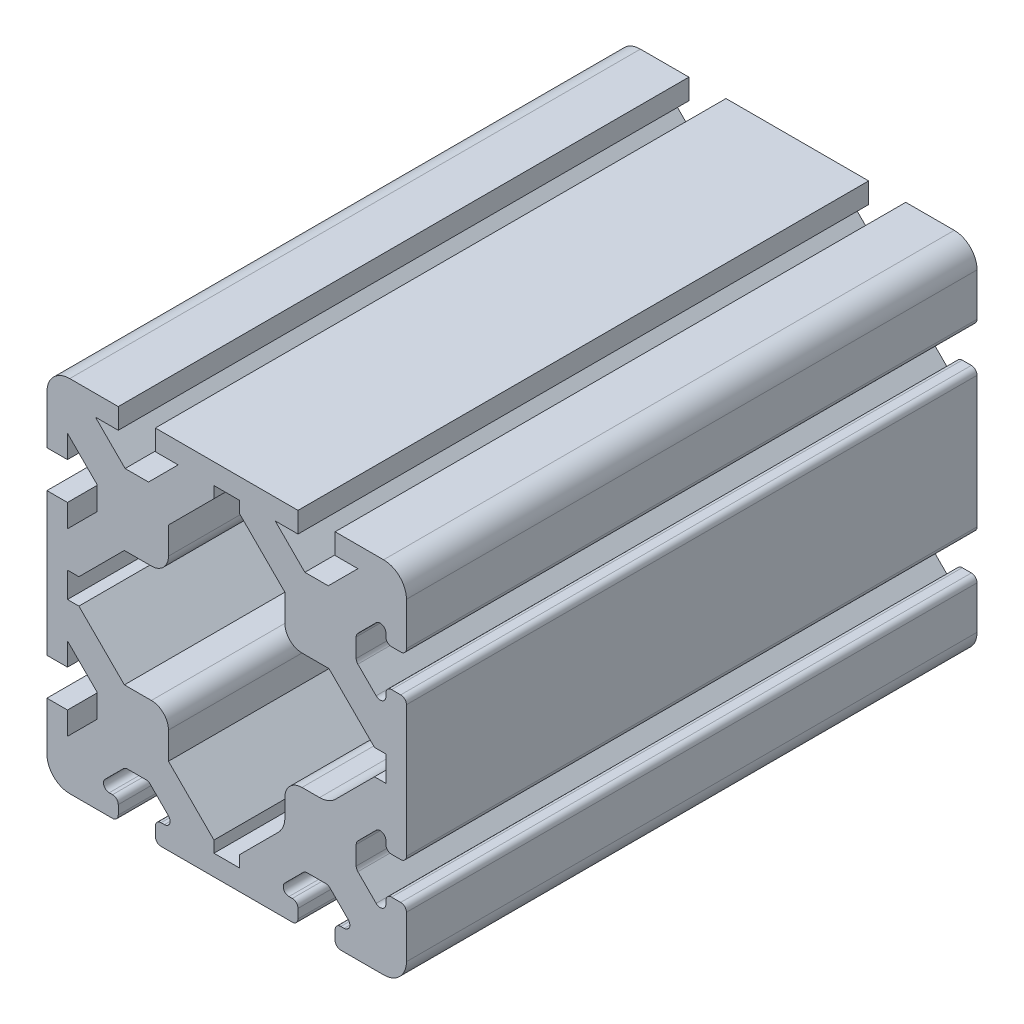
from build123d import *

# Parameters (mm, degrees)
SKETCH1_W            = 80.01
SKETCH1_H            = 80.01
BOSS_EXTRUDE1_DEPTH  = 127
FILLET1_R            = 5.08
CUT_EXTRUDE1_DEPTH   = 140.031651253
MIRROR2_COPY_1_DEPTH = 140.031651253
MIRROR3_COPY_1_DEPTH = 140.031651253
MIRROR3_COPY_2_DEPTH = 140.031651253
MIRROR3_COPY_3_DEPTH = 140.031651253
FILLET2_R            = 1.27
CUT_EXTRUDE2_DEPTH   = 140.031651253
MIRROR5_COPY_1_DEPTH = 140.031651253
FILLET3_R            = 3.81
FILLET4_R            = 5.08


with BuildPart() as part:
    # Sketch1 → Boss-Extrude1 (new body)
    with BuildSketch(Plane.XY):
        Rectangle(SKETCH1_W, SKETCH1_H)
    extrude(amount=BOSS_EXTRUDE1_DEPTH)

    # Fillet1
    fillet1_edges = [part.edges().sort_by_distance(p)[0] for p in [
        (-40.005, 40.005, 63.5),
        (40.005, 40.005, 63.5),
        (40.005, -40.005, 63.5),
        (-40.005, -40.005, 63.5),
    ]]
    fillet(fillet1_edges, radius=FILLET1_R)

    # Sketch2 → Cut-Extrude1 (cut, through all)
    with BuildSketch(Plane.XY.offset(127)):
        Polygon((24.13, -40.005), (24.13, -35.433), (29.21, -35.433), (22.606, -28.829), (17.399, -28.829), (10.795, -35.433), (15.875, -35.433), (15.875, -40.005), align=None)
    cut_extrude1 = extrude(amount=-CUT_EXTRUDE1_DEPTH, mode=Mode.SUBTRACT)

    # Mirror1: Cut-Extrude1 across plane
    add(cut_extrude1.mirror(Plane(origin=(0, 0, 0), x_dir=(0, 0, 1), z_dir=(1, 0, 0))), mode=Mode.SUBTRACT)

    # Mirror2: Cut-Extrude1 across plane
    add(cut_extrude1.mirror(Plane.ZX), mode=Mode.SUBTRACT)

    # Mirror2 copy 1 sketch → Mirror2 copy 1 (cut, through all)
    with BuildSketch(Plane(origin=(0, 0, 127), x_dir=(-1, 0, 0), z_dir=(0, 0, 1))):
        Polygon((24.13, -40.005), (24.13, -35.433), (29.21, -35.433), (22.606, -28.829), (17.399, -28.829), (10.795, -35.433), (15.875, -35.433), (15.875, -40.005), align=None)
    extrude(amount=-MIRROR2_COPY_1_DEPTH, mode=Mode.SUBTRACT)

    # Mirror3: Cut-Extrude1 across plane
    add(cut_extrude1.mirror(Plane(origin=(0, 0, 0), x_dir=(0, 0, 1), z_dir=(0.7071067811865475, 0.7071067811865477, 0))), mode=Mode.SUBTRACT)

    # Mirror3 copy 1 sketch → Mirror3 copy 1 (cut, through all)
    with BuildSketch(Plane(origin=(0, 0, 127), x_dir=(0, 1, 0), z_dir=(0, 0, 1))):
        Polygon((24.13, -40.005), (24.13, -35.433), (29.21, -35.433), (22.606, -28.829), (17.399, -28.829), (10.795, -35.433), (15.875, -35.433), (15.875, -40.005), align=None)
    extrude(amount=-MIRROR3_COPY_1_DEPTH, mode=Mode.SUBTRACT)

    # Mirror3 copy 2 sketch → Mirror3 copy 2 (cut, through all)
    with BuildSketch(Plane(origin=(0, 0, 127), x_dir=(0, -1, 0), z_dir=(0, 0, 1))):
        Polygon((24.13, -40.005), (24.13, -35.433), (29.21, -35.433), (22.606, -28.829), (17.399, -28.829), (10.795, -35.433), (15.875, -35.433), (15.875, -40.005), align=None)
    extrude(amount=-MIRROR3_COPY_2_DEPTH, mode=Mode.SUBTRACT)

    # Mirror3 copy 3 sketch → Mirror3 copy 3 (cut, through all)
    with BuildSketch(Plane(origin=(0, 0, 127), x_dir=(0, 1, 0), z_dir=(0, 0, 1))):
        Polygon((24.13, 40.005), (24.13, 35.433), (29.21, 35.433), (22.606, 28.829), (17.399, 28.829), (10.795, 35.433), (15.875, 35.433), (15.875, 40.005), align=None)
    extrude(amount=-MIRROR3_COPY_3_DEPTH, mode=Mode.SUBTRACT)

    # Fillet2
    fillet2_edges = [part.edges().sort_by_distance(p)[0] for p in [
        (40.005, 24.13, 63.5),
        (40.005, 15.875, 63.5),
        (35.433, 15.875, 63.5),
        (35.433, 10.795, 63.5),
        (28.829, 17.399, 63.5),
        (28.829, 22.606, 63.5),
        (35.433, 29.21, 63.5),
        (35.433, 24.13, 63.5),
        (40.005, -15.875, 63.5),
        (40.005, -24.13, 63.5),
        (35.433, -24.13, 63.5),
        (35.433, -29.21, 63.5),
        (28.829, -22.606, 63.5),
        (28.829, -17.399, 63.5),
        (35.433, -10.795, 63.5),
        (35.433, -15.875, 63.5),
        (24.13, -40.005, 63.5),
        (15.875, -40.005, 63.5),
        (15.875, -35.433, 63.5),
        (10.795, -35.433, 63.5),
        (17.399, -28.829, 63.5),
        (22.606, -28.829, 63.5),
        (29.21, -35.433, 63.5),
        (24.13, -35.433, 63.5),
        (-15.875, -40.005, 63.5),
        (-24.13, -40.005, 63.5),
        (-24.13, -35.433, 63.5),
        (-29.21, -35.433, 63.5),
        (-22.606, -28.829, 63.5),
        (-17.399, -28.829, 63.5),
        (-10.795, -35.433, 63.5),
        (-15.875, -35.433, 63.5),
    ]]
    fillet(fillet2_edges, radius=FILLET2_R)

    # Sketch5 → Cut-Extrude2 (cut, through all)
    with BuildSketch(Plane.XY.offset(127)):
        Polygon((2.83202674, -32.893), (12.954, -22.77102674), (12.954, -12.954), (22.77102674, -12.954), (32.893, -2.83202674), (35.433, -2.83202674), (35.433, 0), (0, 0), (0, -35.433), (2.83202674, -35.433), align=None)
    cut_extrude2 = extrude(amount=-CUT_EXTRUDE2_DEPTH, mode=Mode.SUBTRACT)

    # Mirror4: Cut-Extrude2 across plane
    add(cut_extrude2.mirror(Plane.ZX), mode=Mode.SUBTRACT)

    # Mirror5: Cut-Extrude2 across plane
    add(cut_extrude2.mirror(Plane(origin=(0, 0, 0), x_dir=(0, 0, 1), z_dir=(1, 0, 0))), mode=Mode.SUBTRACT)

    # Mirror5 copy 1 sketch → Mirror5 copy 1 (cut, through all)
    with BuildSketch(Plane(origin=(0, 0, 127), x_dir=(-1, 0, 0), z_dir=(0, 0, 1))):
        Polygon((2.83202674, -32.893), (12.954, -22.77102674), (12.954, -12.954), (22.77102674, -12.954), (32.893, -2.83202674), (35.433, -2.83202674), (35.433, 0), (0, 0), (0, -35.433), (2.83202674, -35.433), align=None)
    extrude(amount=-MIRROR5_COPY_1_DEPTH, mode=Mode.SUBTRACT)

    # Fillet3
    fillet3_edges = [part.edges().sort_by_distance(p)[0] for p in [
        (12.954, -12.954, 63.5),
        (12.954, 12.954, 63.5),
        (-12.954, 12.954, 63.5),
        (-12.954, -12.954, 63.5),
    ]]
    fillet(fillet3_edges, radius=FILLET3_R)

    # Fillet4
    fillet4_edges = [part.edges().sort_by_distance(p)[0] for p in [
        (22.77102674, -12.954, 63.5),
        (12.954, -22.77102674, 63.5),
    ]]
    fillet(fillet4_edges, radius=FILLET4_R)


solid = part.part
